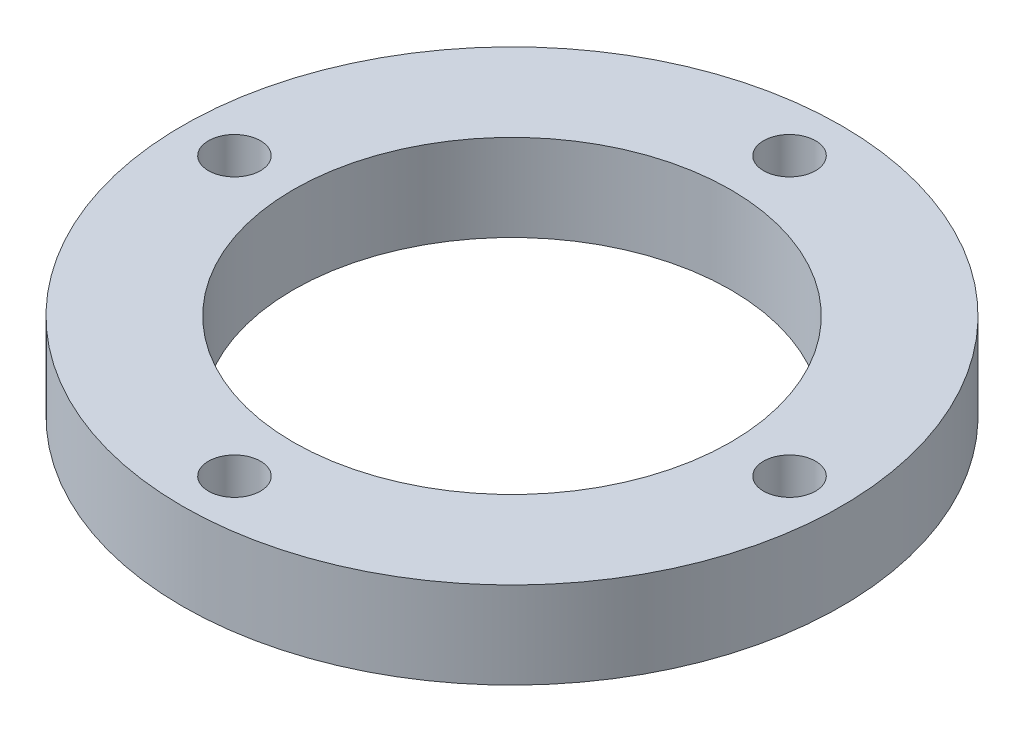
from build123d import *

# Parameters (mm, degrees)
SKETCH_1_R          = 19
SKETCH_1_R_2        = 12.61
EXTRUDE_1_DEPTH     = 5
SKETCH_2_R          = 1.5
CUT_EXTRUDE_2_DEPTH = 5


with BuildPart() as part:
    # Эскиз1 → Вытянуть1 (new body)
    with BuildSketch(Plane(origin=(0, 0, 0), x_dir=(1, 0, 0), z_dir=(0, 1, 0))):
        with Locations(Location((0, 0, 0), (0, 0, 270))):
            Circle(SKETCH_1_R)
        with Locations(Location((0, 0, 0), (0, 0, 270))):
            Circle(SKETCH_1_R_2, mode=Mode.SUBTRACT)
    extrude(amount=EXTRUDE_1_DEPTH)

    # Эскиз2 → Вытянуть2 (cut)
    with BuildSketch(Plane(origin=(0, 5, 0), x_dir=(1, 0, 0), z_dir=(0, 1, 0))):
        with Locations(Location((0, 16, 0), (0, 0, 270))):
            Circle(SKETCH_2_R)
        with Locations(Location((16, 0, 0), (0, 0, 270))):
            Circle(SKETCH_2_R)
        with Locations(Location((0, -16, 0), (0, 0, 270))):
            Circle(SKETCH_2_R)
        with Locations(Location((-16, 0, 0), (0, 0, 270))):
            Circle(SKETCH_2_R)
    extrude(amount=-CUT_EXTRUDE_2_DEPTH, mode=Mode.SUBTRACT)


solid = part.part
